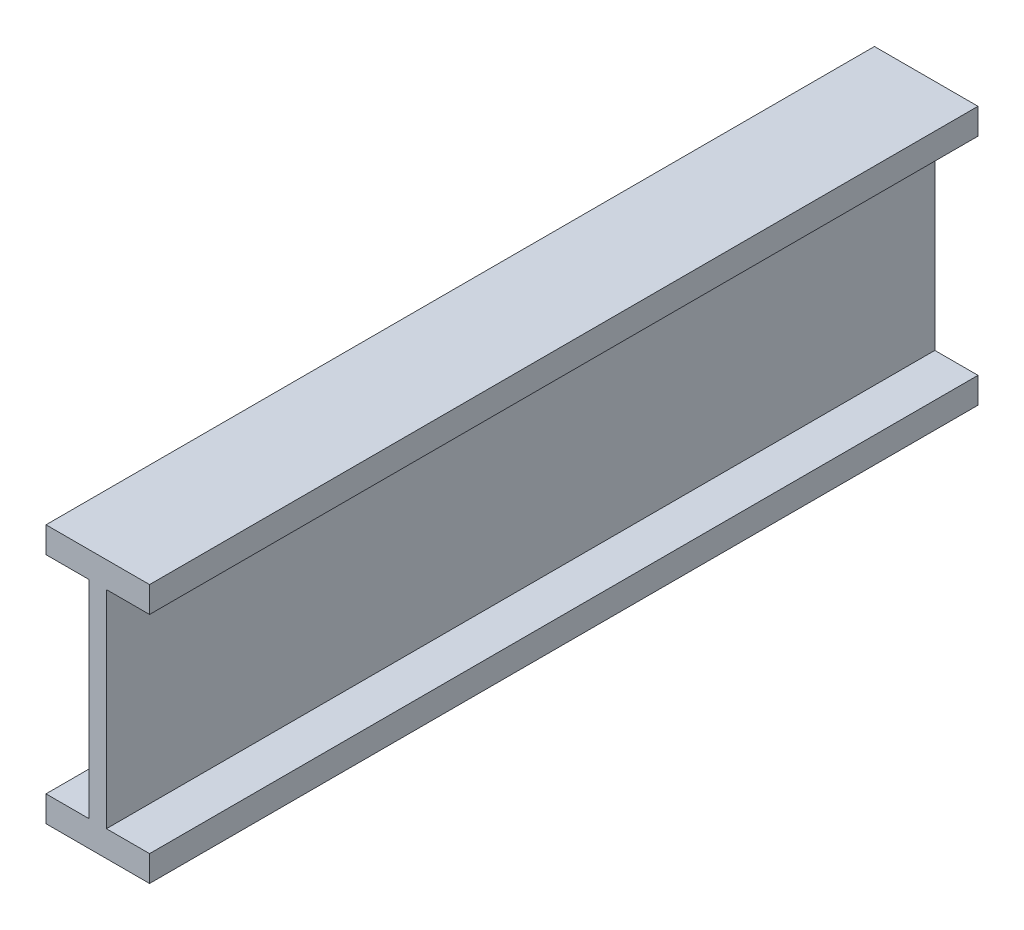
from build123d import *

# Parameters (mm, degrees)
SKETCH2_W           = 25.4
SKETCH2_H           = 304.8
BOSS_EXTRUDE1_DEPTH = 1219.2


with BuildPart() as part:
    # Sketch2 → Boss-Extrude1 (new body)
    with BuildSketch(Plane.XY):
        Polygon((-76.2, 152.4), (-12.7, 152.4), (12.7, 152.4), (76.2, 152.4), (76.2, 190.5), (-76.2, 190.5), align=None)
        Rectangle(SKETCH2_W, SKETCH2_H)
        Polygon((12.7, -152.4), (-12.7, -152.4), (-76.2, -152.4), (-76.2, -190.5), (76.2, -190.5), (76.2, -152.4), align=None)
    extrude(amount=BOSS_EXTRUDE1_DEPTH)


solid = part.part
